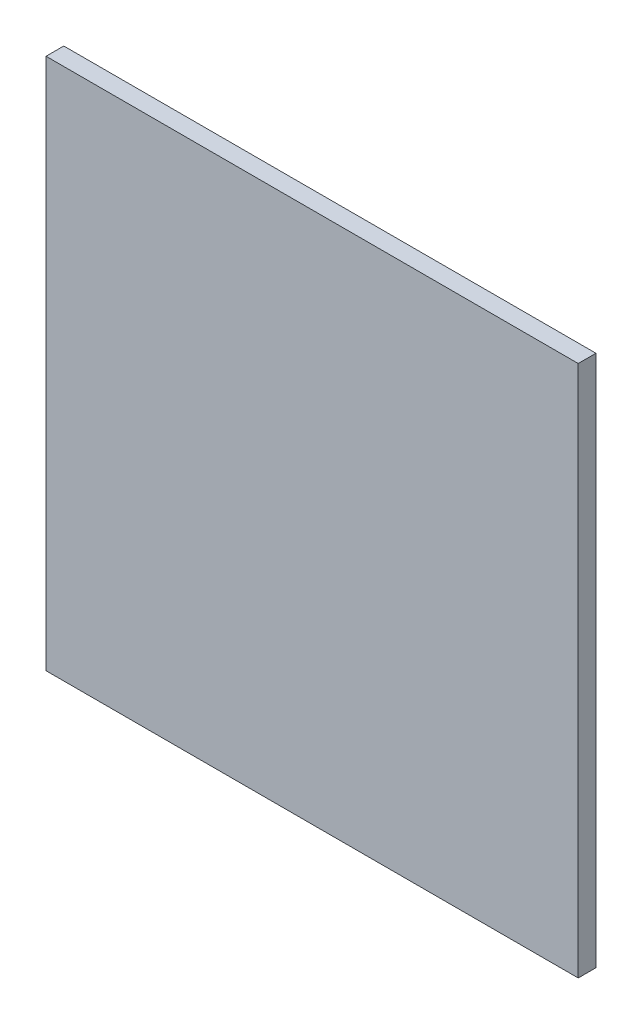
from build123d import *

# Parameters (mm, degrees)
SKETCH2_W           = 0.6
SKETCH2_H           = 0.6
BOSS_EXTRUDE1_DEPTH = 0.01


with BuildPart() as part:
    # Sketch2 → Boss-Extrude1 (new, symmetric)
    with BuildSketch(Plane.XY):
        Rectangle(SKETCH2_W, SKETCH2_H)
    extrude(amount=BOSS_EXTRUDE1_DEPTH, both=True)


solid = part.part
